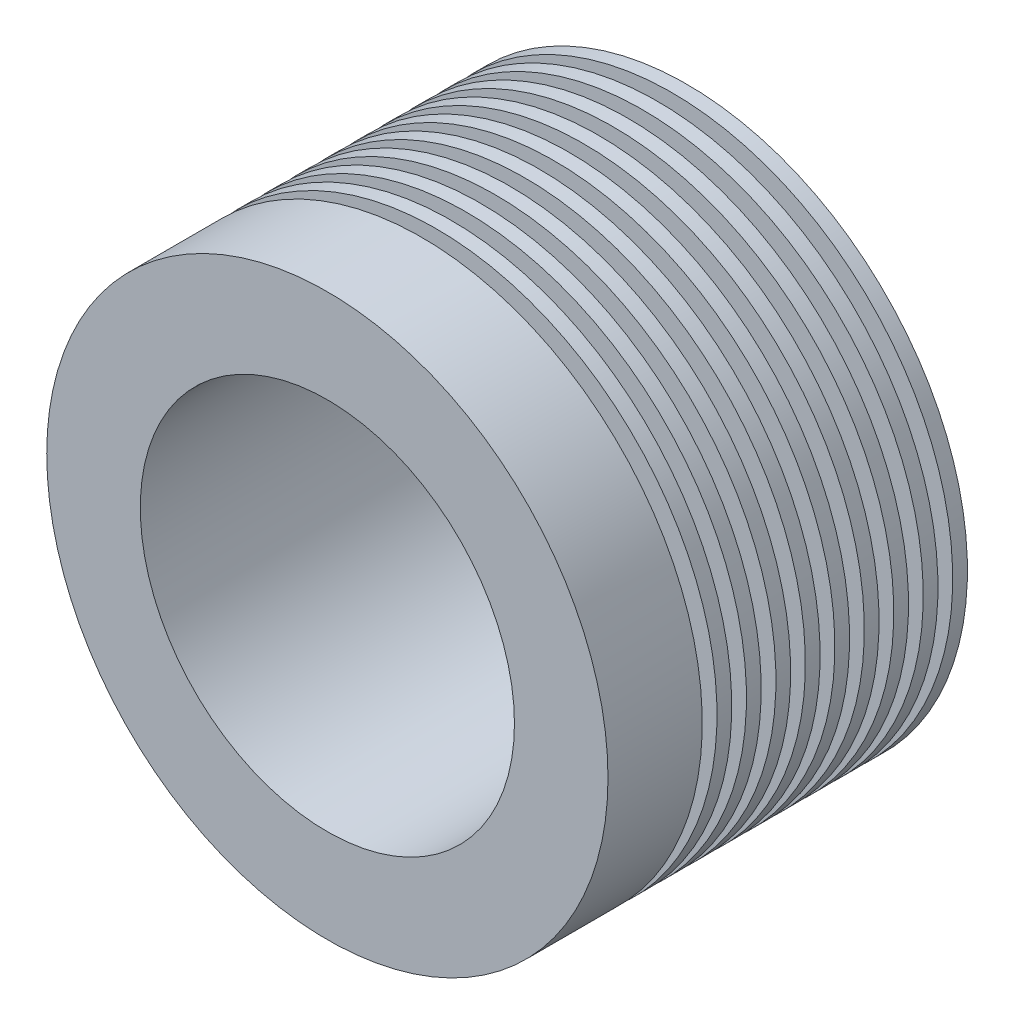
from build123d import *

# Parameters (mm, degrees)
ESQUISSE1_R                = 38.1
BOSS_EXTRU_1_DEPTH         = 50.8
ESQUISSE2_OUTSIDE_W        = 102.028
ESQUISSE2_OUTSIDE_H        = 102.028
ESQUISSE2_OUTSIDE_R        = 31.75
ENL_V_MAT_EXTRU_3_DEPTH    = 2
R_P_TITION_LIN_AIRE1_COUNT = 10
R_P_TITION_LIN_AIRE1_PITCH = 4
ESQUISSE5_R                = 25.4
ENL_V_MAT_EXTRU_5_DEPTH    = 38.1


with BuildPart() as part:
    # Esquisse1 → Boss.-Extru.1 (new body)
    with BuildSketch(Plane.XY):
        Circle(ESQUISSE1_R)
    extrude(amount=BOSS_EXTRU_1_DEPTH)

    # Esquisse2 outside → Enlèv. mat.-Extru.3 (cut)
    with BuildSketch(Plane(origin=(0, 0, 0), x_dir=(-1, 0, 0), z_dir=(0, 0, -1))):
        Rectangle(ESQUISSE2_OUTSIDE_W, ESQUISSE2_OUTSIDE_H)
        Circle(ESQUISSE2_OUTSIDE_R, mode=Mode.SUBTRACT)
    enl_v_mat_extru_3 = extrude(amount=-ENL_V_MAT_EXTRU_3_DEPTH, mode=Mode.SUBTRACT)

    # Répétition linéaire1: Enlèv. mat.-Extru.3 ×10
    with Locations(*[(0, 0, i * R_P_TITION_LIN_AIRE1_PITCH) for i in range(1, R_P_TITION_LIN_AIRE1_COUNT)]):
        add(enl_v_mat_extru_3, mode=Mode.SUBTRACT)

    # Esquisse5 → Enlèv. mat.-Extru.5 (cut)
    with BuildSketch(Plane.XY.offset(50.8)):
        Circle(ESQUISSE5_R)
    extrude(amount=-ENL_V_MAT_EXTRU_5_DEPTH, mode=Mode.SUBTRACT)


solid = part.part
